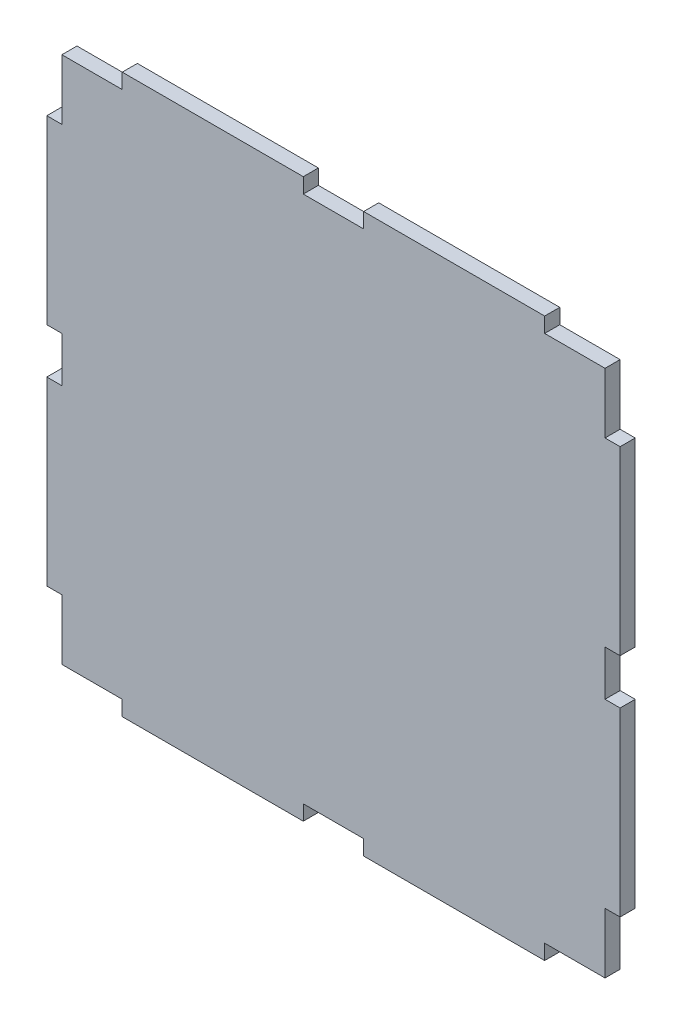
from build123d import *

# Parameters (mm, degrees)
BOSS_EXTRUDE1_DEPTH = 6.35


with BuildPart() as part:
    # Sketch5 → Boss-Extrude1 (new body)
    with BuildSketch(Plane.XY):
        Polygon((170.712770275, -169.278401611), (145.312770275, -169.278401611), (145.312770275, -194.678401611), (138.962770275, -194.678401611), (138.962770275, -270.878401611), (145.312770275, -270.878401611), (145.312770275, -289.928401611), (138.962770275, -289.928401611), (138.962770275, -366.128401611), (145.312770275, -366.128401611), (145.312770275, -391.528401611), (170.712770275, -391.528401611), (170.712770275, -397.878401611), (246.912770275, -397.878401611), (246.912770275, -391.528401611), (272.312770275, -391.528401611), (272.312770275, -397.878401611), (348.512770275, -397.878401611), (348.512770275, -391.528401611), (373.912770275, -391.528401611), (373.912770275, -366.128401611), (380.262770275, -366.128401611), (380.262770275, -289.928401611), (373.912770275, -289.928401611), (373.912770275, -270.878401611), (380.262770275, -270.878401611), (380.262770275, -194.678401611), (373.912770275, -194.678401611), (373.912770275, -169.278401611), (348.512770275, -169.278401611), (348.512770275, -162.928401611), (272.312770275, -162.928401611), (272.312770275, -169.278401611), (246.912770275, -169.278401611), (246.912770275, -162.928401611), (170.712770275, -162.928401611), align=None)
    extrude(amount=BOSS_EXTRUDE1_DEPTH)


solid = part.part
